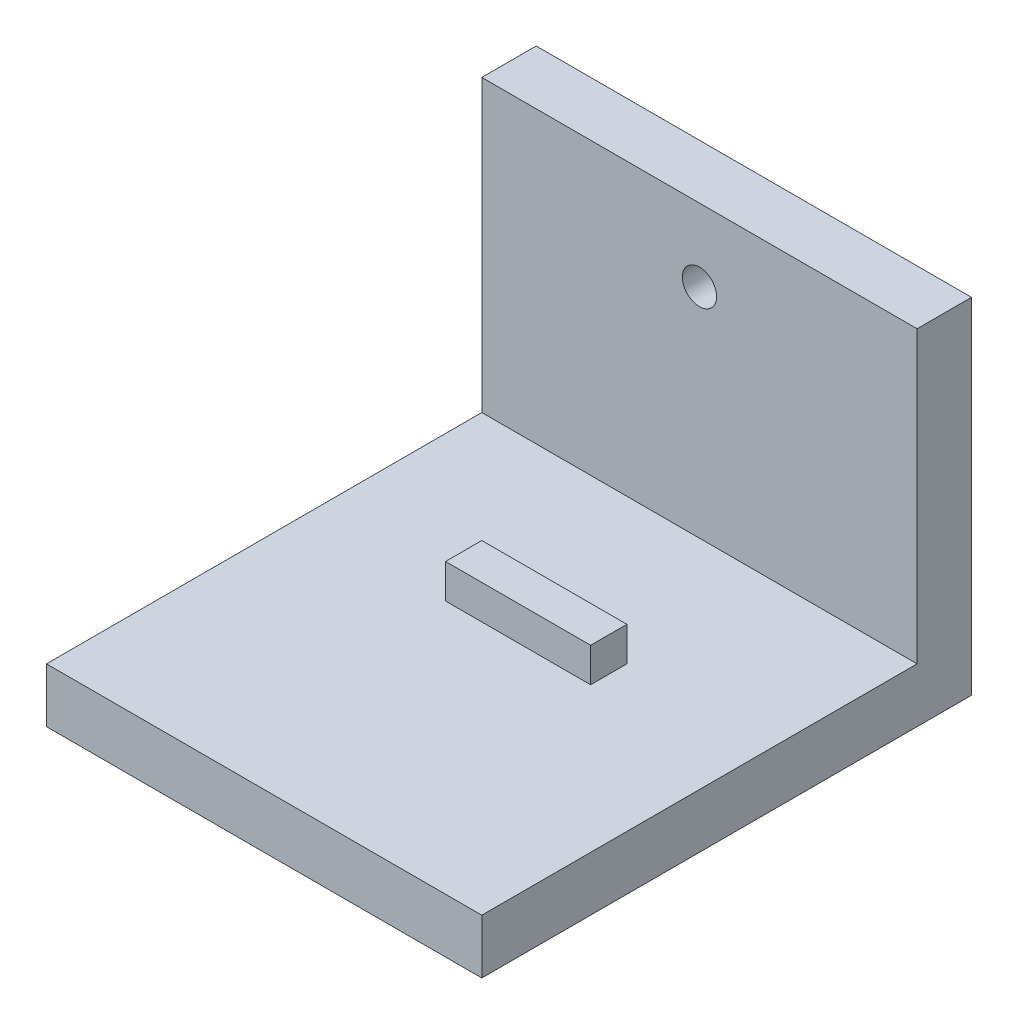
from build123d import *

# Parameters (mm, degrees)
BOSS_EXTRUDE1_DEPTH = 38.1
SKETCH2_W           = 12.7
SKETCH2_H           = 3.175
BOSS_EXTRUDE2_DEPTH = 2.9972
SKETCH3_R           = 1.499997
CUT_EXTRUDE1_DEPTH  = 62.749464826


with BuildPart() as part:
    # Sketch1 → Boss-Extrude1 (new body)
    with BuildSketch(Plane(origin=(0, 0, 0), x_dir=(0, 0, -1), z_dir=(1, 0, 0))):
        Polygon((0, 0), (-42.8625, 0), (-42.8625, 4.7625), (-4.7625, 4.7625), (-4.7625, 30.1625), (0, 30.1625), align=None)
    extrude(amount=BOSS_EXTRUDE1_DEPTH)

    # Sketch2 → Boss-Extrude2 (add)
    with BuildSketch(Plane(origin=(0, 4.7625, 0), x_dir=(1, 0, 0), z_dir=(0, 1, 0))):
        with Locations((19.05, -19.05)):
            Rectangle(SKETCH2_W, SKETCH2_H)
    extrude(amount=BOSS_EXTRUDE2_DEPTH)

    # Sketch3 → Cut-Extrude1 (cut, through all)
    with BuildSketch(Plane.XY.offset(4.7625)):
        with Locations((19.05, 23.8125)):
            Circle(SKETCH3_R)
    extrude(amount=-CUT_EXTRUDE1_DEPTH, mode=Mode.SUBTRACT)


solid = part.part
